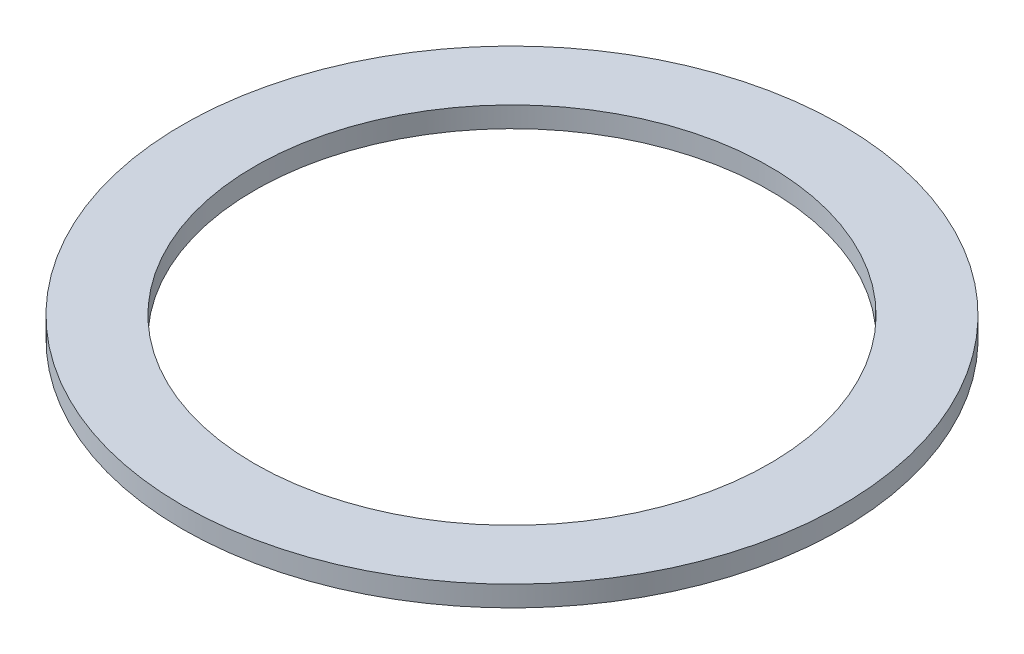
from build123d import *

# Parameters (mm, degrees)
SKETCH_1_R      = 16
SKETCH_1_R_2    = 12.5
EXTRUDE_1_DEPTH = 1


with BuildPart() as part:
    # Эскиз1 → Бобышка-Вытянуть1 (new body)
    with BuildSketch(Plane(origin=(0, 0, 0), x_dir=(1, 0, 0), z_dir=(0, 1, 0))):
        with Locations(Location((0, 0, 0), (0, 0, 270))):
            Circle(SKETCH_1_R)
        with Locations(Location((0, 0, 0), (0, 0, 270))):
            Circle(SKETCH_1_R_2, mode=Mode.SUBTRACT)
    extrude(amount=EXTRUDE_1_DEPTH)


solid = part.part
